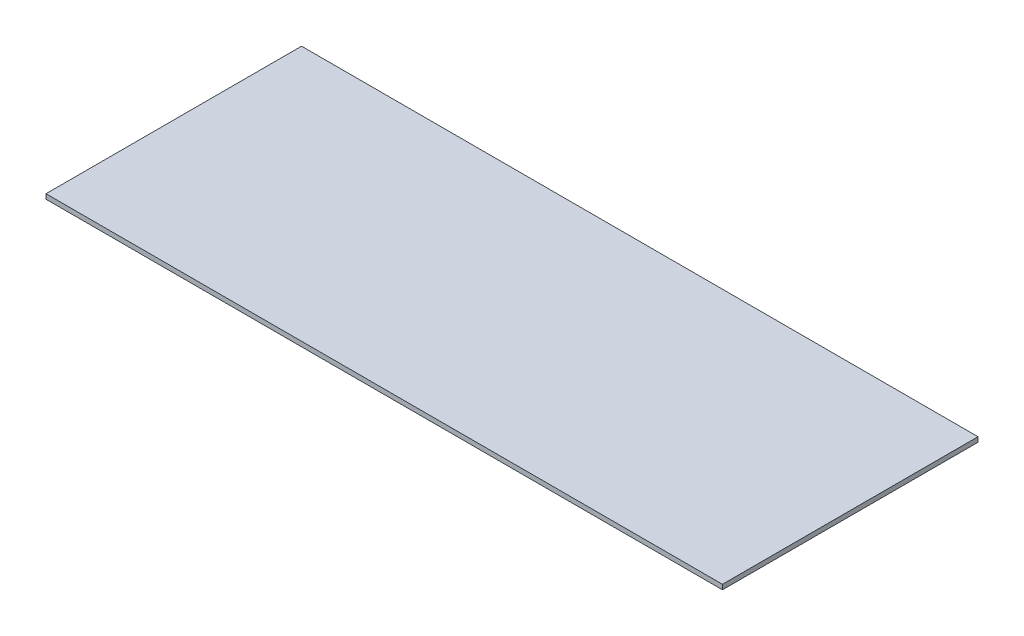
from build123d import *

# Parameters (mm, degrees)
SKETCH1_W           = 357.1875
SKETCH1_H           = 134.9375
BOSS_EXTRUDE1_DEPTH = 2.54


with BuildPart() as part:
    # Sketch1 → Boss-Extrude1 (new body)
    with BuildSketch(Plane(origin=(0, 0, 0), x_dir=(1, 0, 0), z_dir=(0, 1, 0))):
        Rectangle(SKETCH1_W, SKETCH1_H)
    extrude(amount=BOSS_EXTRUDE1_DEPTH)


solid = part.part
